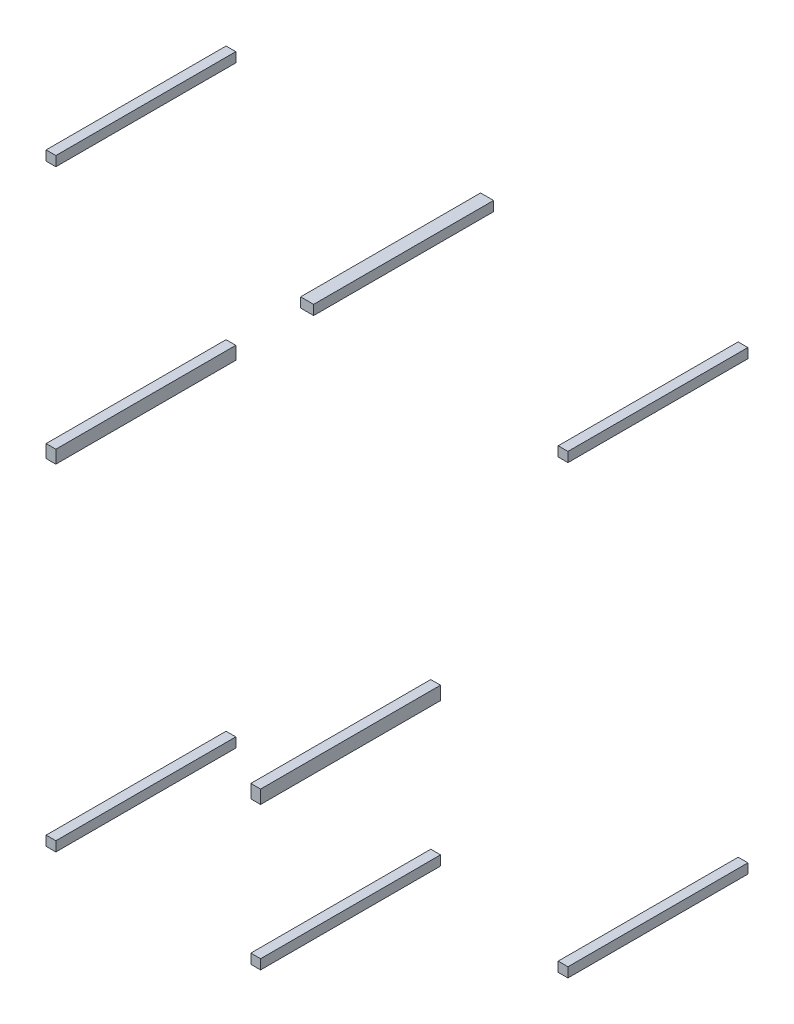
from build123d import *

# Parameters (mm, degrees)
SKETCH_1_W        = 150
SKETCH_1_H        = 150
EXTRUDE_1_DEPTH   = 2768
SKETCH_1_W_2      = 200
EXTRUDE_1_2_DEPTH = 2768
EXTRUDE_1_3_DEPTH = 2768
SKETCH_1_H_2      = 206
EXTRUDE_1_4_DEPTH = 2768
EXTRUDE_1_5_DEPTH = 2768
EXTRUDE_1_6_DEPTH = 2768
EXTRUDE_1_7_DEPTH = 2768
SKETCH_1_H_3      = 200
EXTRUDE_1_8_DEPTH = 2768


with BuildPart() as part:
    # Эскиз1 → Бобышка-Вытянуть1 (new body)
    with BuildSketch(Plane.XY):
        with Locations((125, -125)):
            Rectangle(SKETCH_1_W, SKETCH_1_H)
    extrude(amount=EXTRUDE_1_DEPTH)


with BuildPart() as body_2:
    # Эскиз1 → Extrude 1 2 (new body)
    with BuildSketch(Plane.XY):
        with Locations((4065, -125)):
            Rectangle(SKETCH_1_W_2, SKETCH_1_H)
    extrude(amount=EXTRUDE_1_2_DEPTH)


with BuildPart() as body_3:
    # Эскиз1 → Extrude 1 3 (new body)
    with BuildSketch(Plane.XY):
        with Locations((8002, -128)):
            Rectangle(SKETCH_1_W, SKETCH_1_H)
    extrude(amount=EXTRUDE_1_3_DEPTH)


with BuildPart() as body_4:
    # Эскиз1 → Extrude 1 4 (new body)
    with BuildSketch(Plane.XY):
        with Locations((3274, -7018)):
            Rectangle(SKETCH_1_W, SKETCH_1_H_2)
    extrude(amount=EXTRUDE_1_4_DEPTH)


with BuildPart() as body_5:
    # Эскиз1 → Extrude 1 5 (new body)
    with BuildSketch(Plane.XY):
        with Locations((8002, -6993)):
            Rectangle(SKETCH_1_W, SKETCH_1_H)
    extrude(amount=EXTRUDE_1_5_DEPTH)


with BuildPart() as body_6:
    # Эскиз1 → Extrude 1 6 (new body)
    with BuildSketch(Plane.XY):
        with Locations((3274, -9250)):
            Rectangle(SKETCH_1_W, SKETCH_1_H)
    extrude(amount=EXTRUDE_1_6_DEPTH)


with BuildPart() as body_7:
    # Эскиз1 → Extrude 1 7 (new body)
    with BuildSketch(Plane.XY):
        with Locations((125, -9253)):
            Rectangle(SKETCH_1_W, SKETCH_1_H)
    extrude(amount=EXTRUDE_1_7_DEPTH)


with BuildPart() as body_8:
    # Эскиз1 → Extrude 1 8 (new body)
    with BuildSketch(Plane.XY):
        with Locations((125, -4062)):
            Rectangle(SKETCH_1_W, SKETCH_1_H_3)
    extrude(amount=EXTRUDE_1_8_DEPTH)


solid = Compound([part.part, body_2.part, body_3.part, body_4.part, body_5.part, body_6.part, body_7.part, body_8.part])
